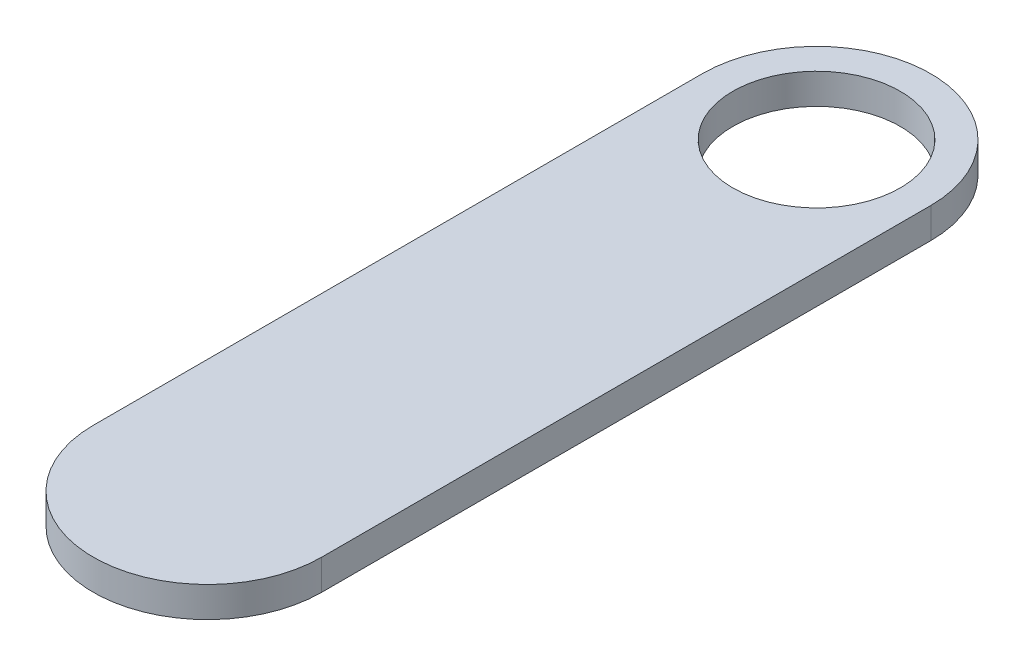
from build123d import *

# Parameters (mm, degrees)
SKETCH2_R           = 5.5
BOSS_EXTRUDE1_DEPTH = 2


with BuildPart() as part:
    # Sketch2 → Boss-Extrude1 (new body)
    with BuildSketch(Plane(origin=(0, 0, 0), x_dir=(1, 0, 0), z_dir=(0, 1, 0))):
        with BuildLine():
            Line((-7.5, 0), (-7.5, 40))
            ThreePointArc((-7.5, 40), (0, 47.5), (7.5, 40))
            Line((7.5, 40), (7.5, 0))
            ThreePointArc((7.5, 0), (0, -7.5), (-7.5, 0))
        make_face()
        with Locations(Location((0, 40, 0), (0, 0, 270))):
            Circle(SKETCH2_R, mode=Mode.SUBTRACT)
    extrude(amount=BOSS_EXTRUDE1_DEPTH)


solid = part.part
